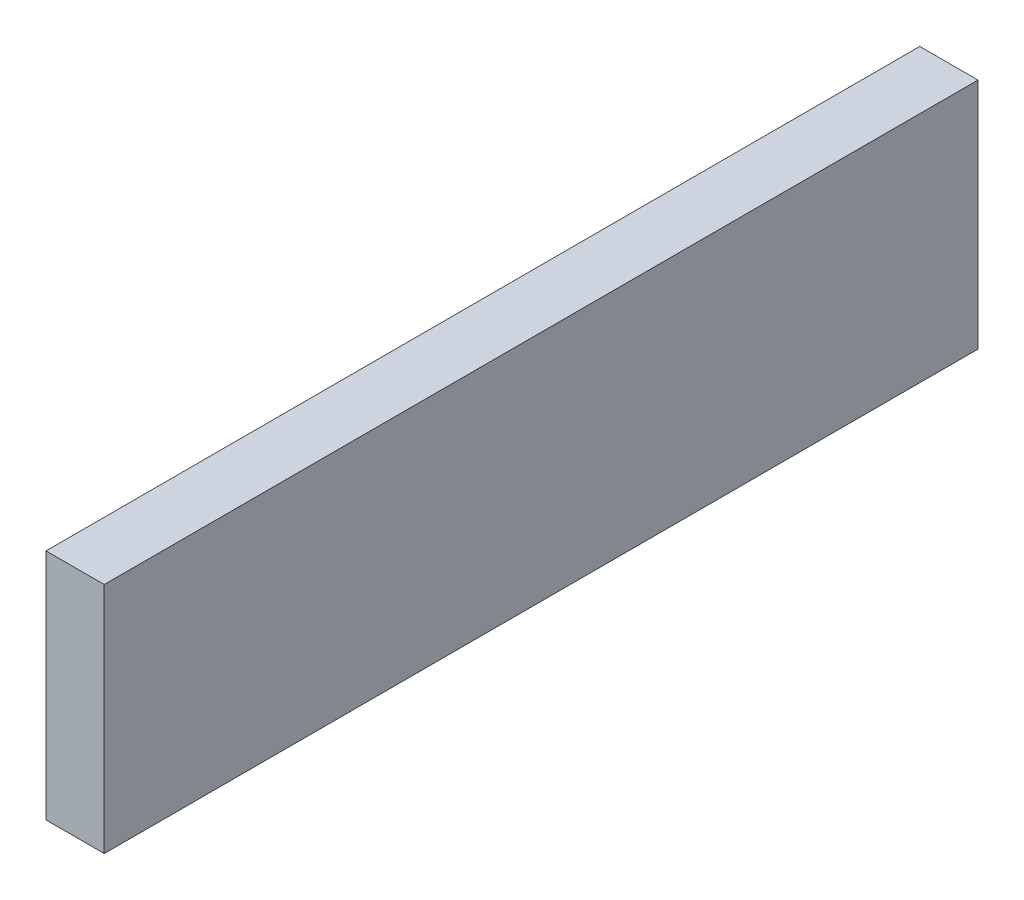
from build123d import *

# Parameters (mm, degrees)
SKETCH1_W           = 95.25
SKETCH1_H           = 25.4
BOSS_EXTRUDE1_DEPTH = 6.35


with BuildPart() as part:
    # Sketch1 → Boss-Extrude1 (new body)
    with BuildSketch(Plane(origin=(0, 0, 0), x_dir=(0, 0, -1), z_dir=(1, 0, 0))):
        with Locations((47.625, -12.7)):
            Rectangle(SKETCH1_W, SKETCH1_H)
    extrude(amount=BOSS_EXTRUDE1_DEPTH)


solid = part.part
